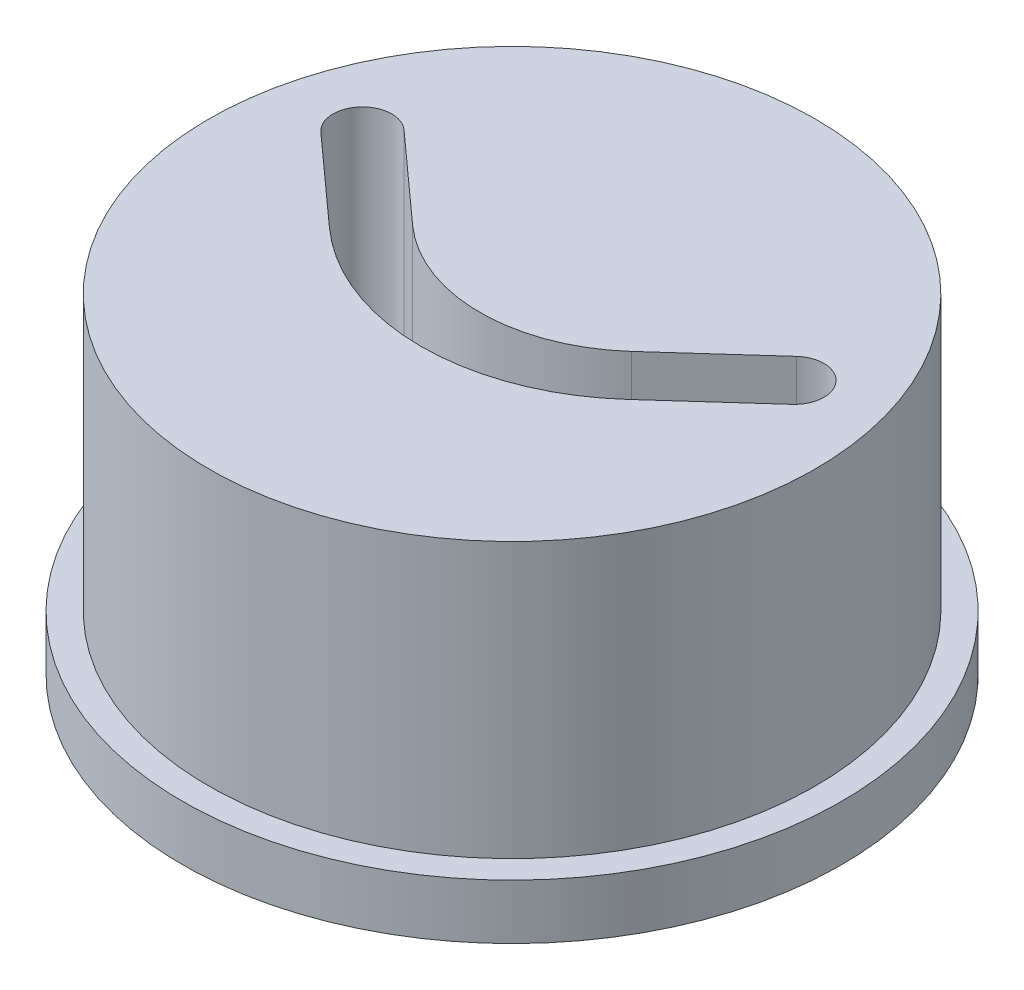
from build123d import *

# Parameters (mm, degrees)
SKETCH2_R           = 17.526
BOSS_EXTRUDE1_DEPTH = 19.05
SKETCH15_R          = 19.05
BOSS_EXTRUDE2_DEPTH = 3.175
CUT_EXTRUDE2_DEPTH  = 12.7


with BuildPart() as part:
    # Sketch2 → Boss-Extrude1 (new body)
    with BuildSketch(Plane(origin=(0, 0, 0), x_dir=(1, 0, 0), z_dir=(0, 1, 0))):
        with Locations(Location((0, 0, 0), (0, 0, 90))):
            Circle(SKETCH2_R)
        with BuildLine():
            Line((-13.081, 3.175), (-8.059107313, -1.349826056))
            ThreePointArc((-8.059107313, -1.349826056), (0, -4.445), (8.059107313, -1.349826056))
            Line((8.059107313, -1.349826056), (13.081, 3.175))
            ThreePointArc((13.081, 3.175), (13.146371637, 4.430535164), (11.890836473, 4.495906802))
            Line((11.890836473, 4.495906802), (6.868943786, -0.028919255))
            ThreePointArc((6.868943786, -0.028919255), (0, -2.667), (-6.868943786, -0.028919255))
            Line((-6.868943786, -0.028919255), (-11.890836473, 4.495906802))
            ThreePointArc((-11.890836473, 4.495906802), (-13.146371637, 4.430535164), (-13.081, 3.175))
        make_face(mode=Mode.SUBTRACT)
    extrude(amount=BOSS_EXTRUDE1_DEPTH)

    # Sketch15 → Boss-Extrude2 (add)
    with BuildSketch(Plane.XZ):
        with Locations(Location((0, 0, 0), (0, 0, 270))):
            Circle(SKETCH15_R)
        with BuildLine():
            Line((-13.081, -3.175), (-8.059107313, 1.349826056))
            ThreePointArc((-8.059107313, 1.349826056), (0, 4.445), (8.059107313, 1.349826056))
            Line((8.059107313, 1.349826056), (13.081, -3.175))
            ThreePointArc((13.081, -3.175), (13.146371637, -4.430535164), (11.890836473, -4.495906802))
            Line((11.890836473, -4.495906802), (6.868943786, 0.028919255))
            ThreePointArc((6.868943786, 0.028919255), (0, 2.667), (-6.868943786, 0.028919255))
            Line((-6.868943786, 0.028919255), (-11.890836473, -4.495906802))
            ThreePointArc((-11.890836473, -4.495906802), (-13.146371637, -4.430535164), (-13.081, -3.175))
        make_face(mode=Mode.SUBTRACT)
    extrude(amount=-BOSS_EXTRUDE2_DEPTH)

    # Sketch14 → Cut-Extrude2 (cut)
    with BuildSketch(Plane(origin=(0, 19.05, 0), x_dir=(1, 0, 0), z_dir=(0, 1, 0))):
        with BuildLine():
            Line((8.603182068, -1.953669166), (13.625074755, 2.571156891))
            ThreePointArc((13.625074755, 2.571156891), (13.750214746, 4.97460992), (11.346761717, 5.099749911))
            Line((11.346761717, 5.099749911), (6.32486903, 0.574923855))
            ThreePointArc((6.32486903, 0.574923855), (0, -1.8542), (-6.32486903, 0.574923855))
            Line((-6.32486903, 0.574923855), (-11.346761717, 5.099749911))
            ThreePointArc((-11.346761717, 5.099749911), (-13.750214746, 4.97460992), (-13.625074755, 2.571156891))
            Line((-13.625074755, 2.571156891), (-8.603182068, -1.953669166))
            ThreePointArc((-8.603182068, -1.953669166), (0, -5.2578), (8.603182068, -1.953669166))
        make_face()
    extrude(amount=-CUT_EXTRUDE2_DEPTH, mode=Mode.SUBTRACT)


solid = part.part
